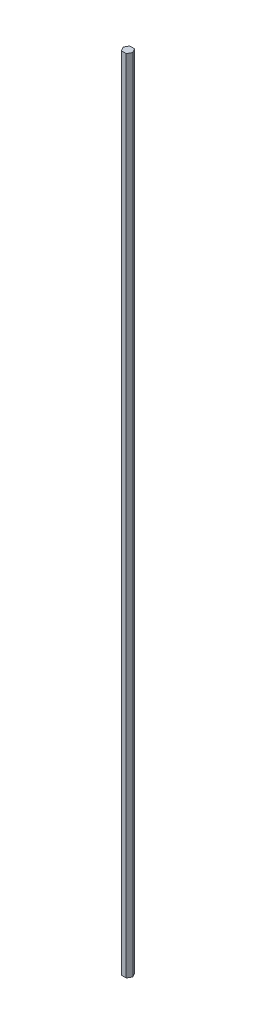
from build123d import *

# Parameters (mm, degrees)
BOSS_EXTRUDE1_DEPTH = 304.8


with BuildPart() as part:
    # Sketch1 → Boss-Extrude1 (new body)
    with BuildSketch(Plane(origin=(0, 0, 0), x_dir=(1, 0, 0), z_dir=(0, 1, 0))):
        Polygon((0.469518969, -0.447160923), (1.385926175, 1.140417789), (0.469246283, 2.727839065), (-1.363840815, 2.72768163), (-2.280248021, 1.140102918), (-1.363568129, -0.447318358), align=None)
    extrude(amount=BOSS_EXTRUDE1_DEPTH)


solid = part.part
